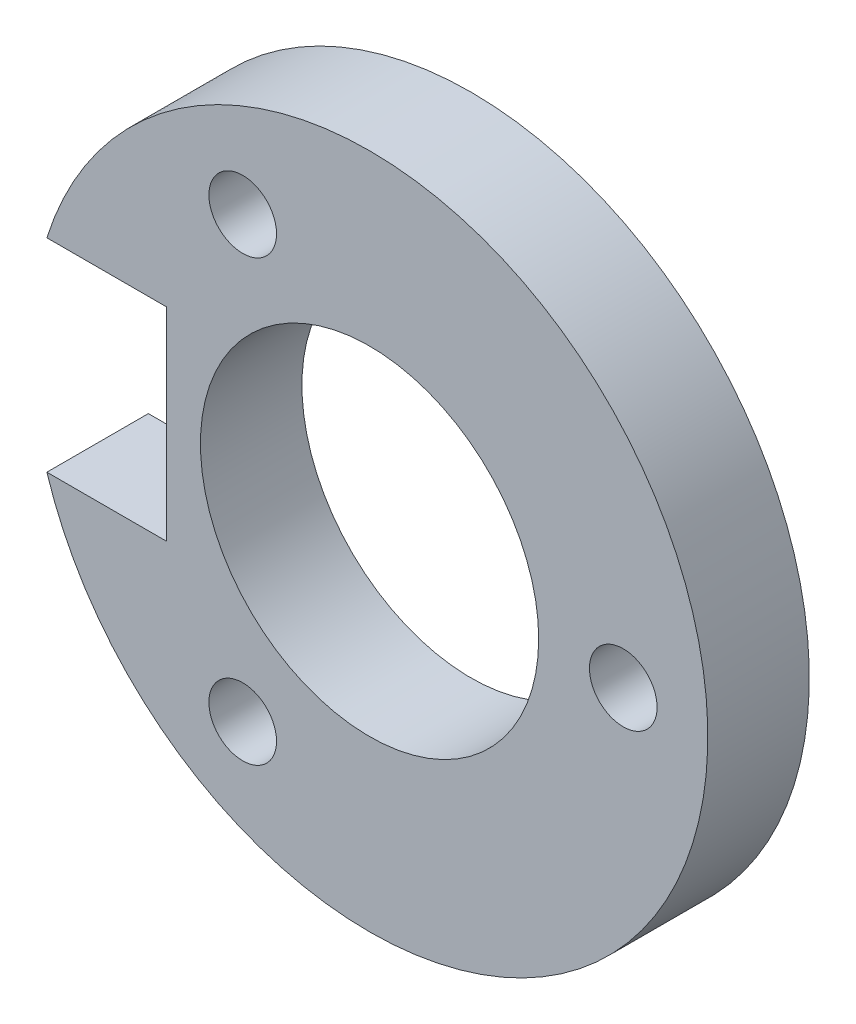
from build123d import *

# Parameters (mm, degrees)
CROQUIS1_R              = 1
CROQUIS1_R_2            = 5
SALIENTE_EXTRUIR1_DEPTH = 3


with BuildPart() as part:
    # Croquis1 → Saliente-Extruir1 (new body)
    with BuildSketch(Plane.XY):
        with BuildLine():
            Line((-9.539392014, 3), (-6, 3))
            Line((-6, 3), (-6, -3))
            Line((-6, -3), (-9.539392014, -3))
            ThreePointArc((-9.539392014, -3), (10, 0), (-9.539392014, 3))
        make_face()
        with Locations((-3.75, -6.495190528)):
            Circle(CROQUIS1_R, mode=Mode.SUBTRACT)
        with Locations((7.5, 0)):
            Circle(CROQUIS1_R, mode=Mode.SUBTRACT)
        Circle(CROQUIS1_R_2, mode=Mode.SUBTRACT)
        with Locations((-3.75, 6.495190528)):
            Circle(CROQUIS1_R, mode=Mode.SUBTRACT)
    extrude(amount=SALIENTE_EXTRUIR1_DEPTH)


solid = part.part
